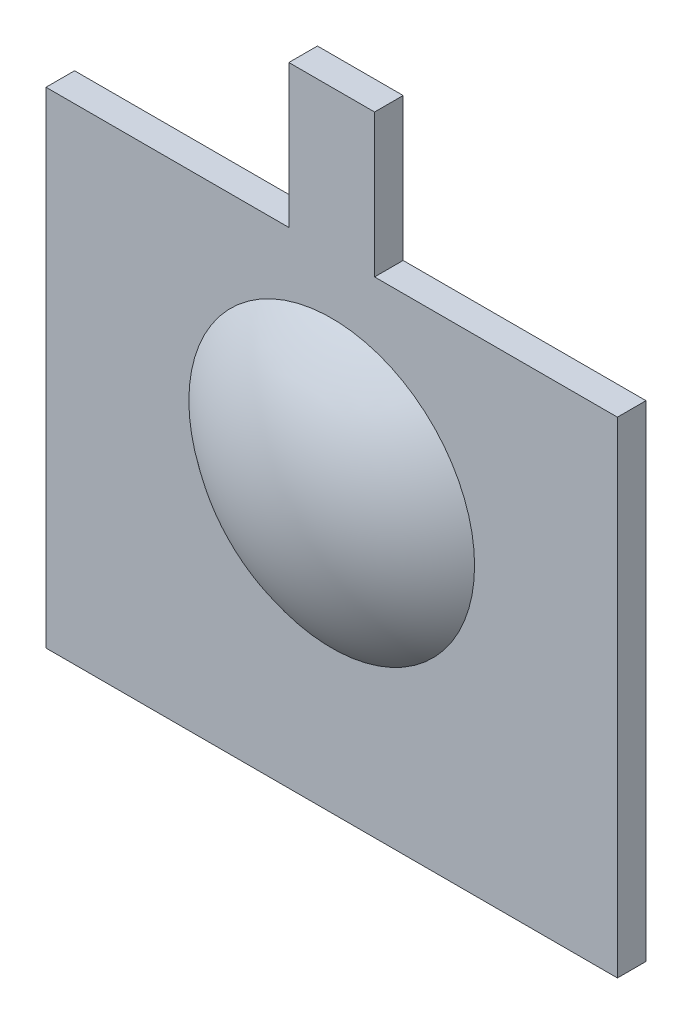
from build123d import *

# Parameters (mm, degrees)
PLUS_PLATE_10_X_8_5_X_0_5_SKETCH_W = 10
PLUS_PLATE_10_X_8_5_X_0_5_SKETCH_H = 0.5
PLUS_PLATE_10_X_8_5_X_0_5_DEPTH    = 8.5
SOLDER_TAB_1_5_X_2_5_SKETCH_W      = 1.5
SOLDER_TAB_1_5_X_2_5_SKETCH_H      = 0.5
SOLDER_TAB_1_5_X_2_5_DEPTH         = 2.5


with BuildPart() as part:
    # Plus Plate 10 x 8.5 x 0.5 Sketch → Plus Plate 10 x 8.5 x 0.5 (new body)
    with BuildSketch(Plane(origin=(0, 1.95, 0), x_dir=(1, 0, 0), z_dir=(0, 1, 0))):
        with Locations((14.3, 65.1)):
            Rectangle(PLUS_PLATE_10_X_8_5_X_0_5_SKETCH_W, PLUS_PLATE_10_X_8_5_X_0_5_SKETCH_H)
    extrude(amount=PLUS_PLATE_10_X_8_5_X_0_5_DEPTH)

    # Solder Tab 1.5 x 2.5 Sketch → Solder Tab 1.5 x 2.5 (add)
    with BuildSketch(Plane(origin=(0, 10.45, 0), x_dir=(1, 0, 0), z_dir=(0, 1, 0))):
        with Locations((14.3, 65.1)):
            Rectangle(SOLDER_TAB_1_5_X_2_5_SKETCH_W, SOLDER_TAB_1_5_X_2_5_SKETCH_H)
    extrude(amount=SOLDER_TAB_1_5_X_2_5_DEPTH)

    # Dimple 0.9 Sketch → Dimple 0.9 (revolve)
    with BuildSketch(Plane(origin=(0, 6.95, 0), x_dir=(1, 0, 0), z_dir=(0, 1, 0))):
        with BuildLine():
            Line((14.3, 64.85), (16.8, 64.85))
            ThreePointArc((16.8, 64.85), (15.628533026, 64.181852707), (14.3, 63.95))
            Line((14.3, 63.95), (14.3, 64.85))
        make_face()
    revolve(axis=Axis((14.3, 6.95, -65.85), (0, 0, 1)))


solid = part.part
